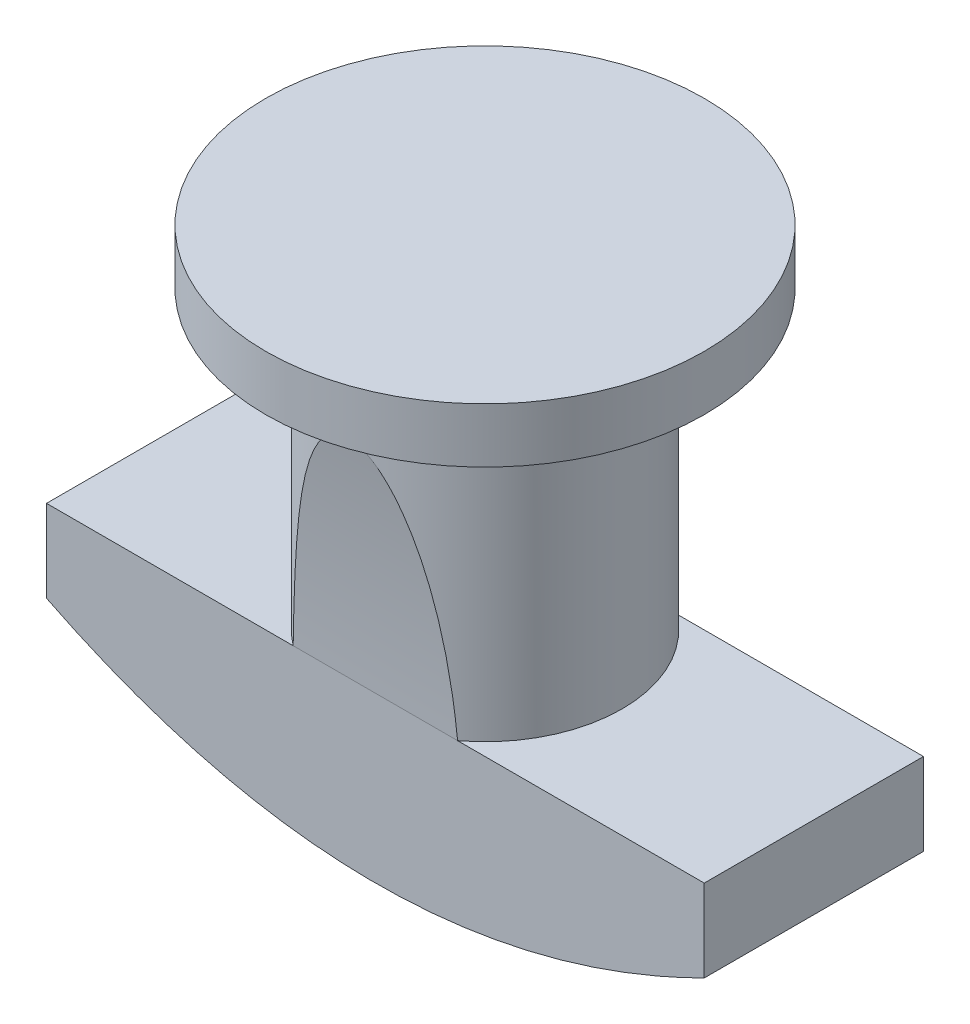
from build123d import *

# Parameters (mm, degrees)
SKETCH1_R               = 4
BOSS_EXTRUDE1_DEPTH     = 1
SKETCH2_R               = 2.5
BOSS_EXTRUDE2_DEPTH     = 5.4
SKETCH3_W               = 12
SKETCH3_H               = 4
BOSS_EXTRUDE3_DEPTH     = 3
CUT_EXTRUDE1_DEPTH      = 12.939849245
CUT_EXTRUDE1_DEPTH_BACK = 12.939849245
CUT_EXTRUDE2_DEPTH      = 12.070682133
CUT_EXTRUDE2_DEPTH_BACK = 12.070682133


with BuildPart() as part:
    # Sketch1 → Boss-Extrude1 (new body)
    with BuildSketch(Plane(origin=(0, 0, 0), x_dir=(1, 0, 0), z_dir=(0, 1, 0))):
        with Locations(Location((0, 0, 0), (0, 0, 270))):
            Circle(SKETCH1_R)
    extrude(amount=BOSS_EXTRUDE1_DEPTH)

    # Sketch2 → Boss-Extrude2 (add)
    with BuildSketch(Plane(origin=(0, 0, 0), x_dir=(-1, 0, 0), z_dir=(0, -1, 0))):
        with Locations(Location((0, 0, 0), (0, 0, 270))):
            Circle(SKETCH2_R)
    extrude(amount=BOSS_EXTRUDE2_DEPTH)

    # Sketch3 → Boss-Extrude3 (add)
    with BuildSketch(Plane.XZ.offset(5.4)):
        Rectangle(SKETCH3_W, SKETCH3_H)
    extrude(amount=BOSS_EXTRUDE3_DEPTH)

    # Sketch4 → Cut-Extrude1 (cut, two sides: drawn at the far end of the back side and taken through both)
    with BuildSketch(Plane(origin=(0, 0, -2), x_dir=(-1, 0, 0), z_dir=(0, 0, -1)).offset(-CUT_EXTRUDE1_DEPTH_BACK)):
        with BuildLine():
            Line((-6, -6.9), (-6.927802535, -6.9))
            Line((-6.927802535, -6.9), (-6.927802535, -9.790233254))
            Line((-6.927802535, -9.790233254), (7.497210963, -9.790233254))
            Line((7.497210963, -9.790233254), (7.497210963, -6.84173926))
            Line((7.497210963, -6.84173926), (6, -6.9))
            add(Edge.make_bspline(
                [(6, -6.9), (0, -9.9), (-6, -6.9)],
                knots=[0, 0, 0, 1, 1, 1], degree=2))
        make_face()
    extrude(amount=CUT_EXTRUDE1_DEPTH + CUT_EXTRUDE1_DEPTH_BACK, mode=Mode.SUBTRACT)

    # Sketch5 → Cut-Extrude2 (cut, two sides: drawn at the far end of the back side and taken through both)
    with BuildSketch(Plane(origin=(0, 0, 0), x_dir=(0, 0, -1), z_dir=(1, 0, 0)).offset(-CUT_EXTRUDE2_DEPTH_BACK)):
        with BuildLine():
            Line((2.5, -1.11050973), (3.286969074, -1.11050973))
            Line((3.286969074, -1.11050973), (3.286969074, -6.28949027))
            Line((3.286969074, -6.28949027), (2, -5.4))
            add(Edge.make_bspline(
                [(2.5, -1.11050973), (2.094671437, -3.238964164), (2, -5.4)],
                knots=[0, 0, 0, 1, 1, 1], degree=2))
        make_face()
        with BuildLine():
            Line((-3.286969074, -6.28949027), (-2, -5.4))
            add(Edge.make_bspline(
                [(-2.5, -1.11050973), (-2.094671437, -3.238964164), (-2, -5.4)],
                knots=[0, 0, 0, 1, 1, 1], degree=2))
            Line((-2.5, -1.11050973), (-3.286969074, -1.11050973))
            Line((-3.286969074, -1.11050973), (-3.286969074, -6.28949027))
        make_face()
    extrude(amount=CUT_EXTRUDE2_DEPTH + CUT_EXTRUDE2_DEPTH_BACK, mode=Mode.SUBTRACT)


solid = part.part
